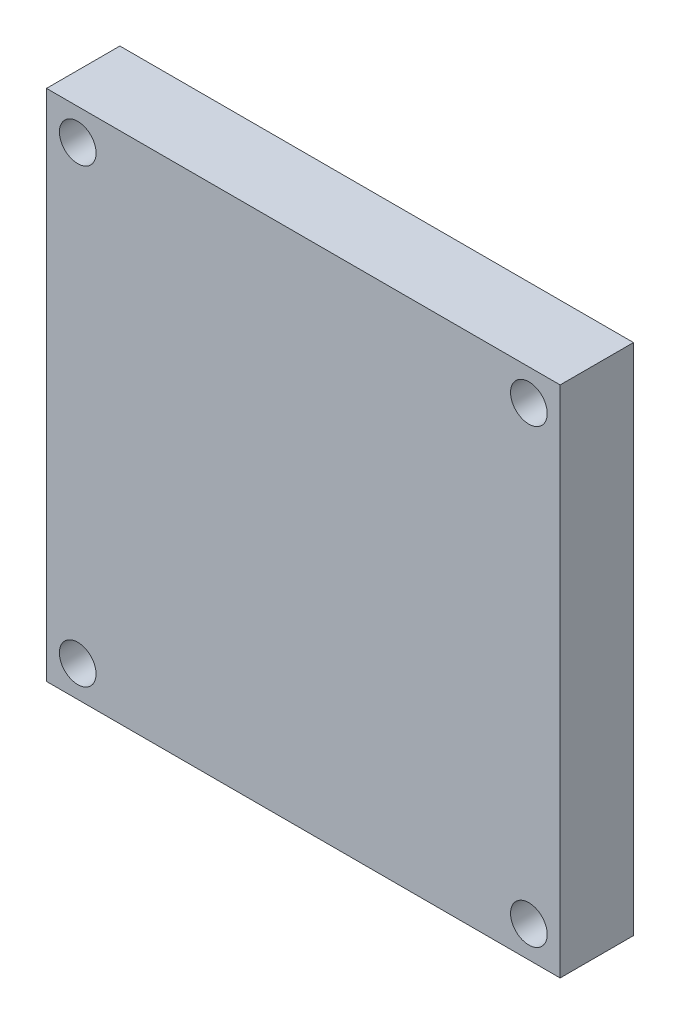
from build123d import *

# Parameters (mm, degrees)
CROQUIS1_W              = 35
CROQUIS1_H              = 35
CROQUIS1_R              = 1.25
SALIENTE_EXTRUIR1_DEPTH = 5


with BuildPart() as part:
    # Croquis1 → Saliente-Extruir1 (new body)
    with BuildSketch(Plane.XY):
        Rectangle(CROQUIS1_W, CROQUIS1_H)
        with Locations((15.37, -15.37)):
            Circle(CROQUIS1_R, mode=Mode.SUBTRACT)
        with Locations((-15.37, -15.37)):
            Circle(CROQUIS1_R, mode=Mode.SUBTRACT)
        with Locations((-15.37, 15.37)):
            Circle(CROQUIS1_R, mode=Mode.SUBTRACT)
        with Locations((15.37, 15.37)):
            Circle(CROQUIS1_R, mode=Mode.SUBTRACT)
    extrude(amount=SALIENTE_EXTRUIR1_DEPTH)


solid = part.part
